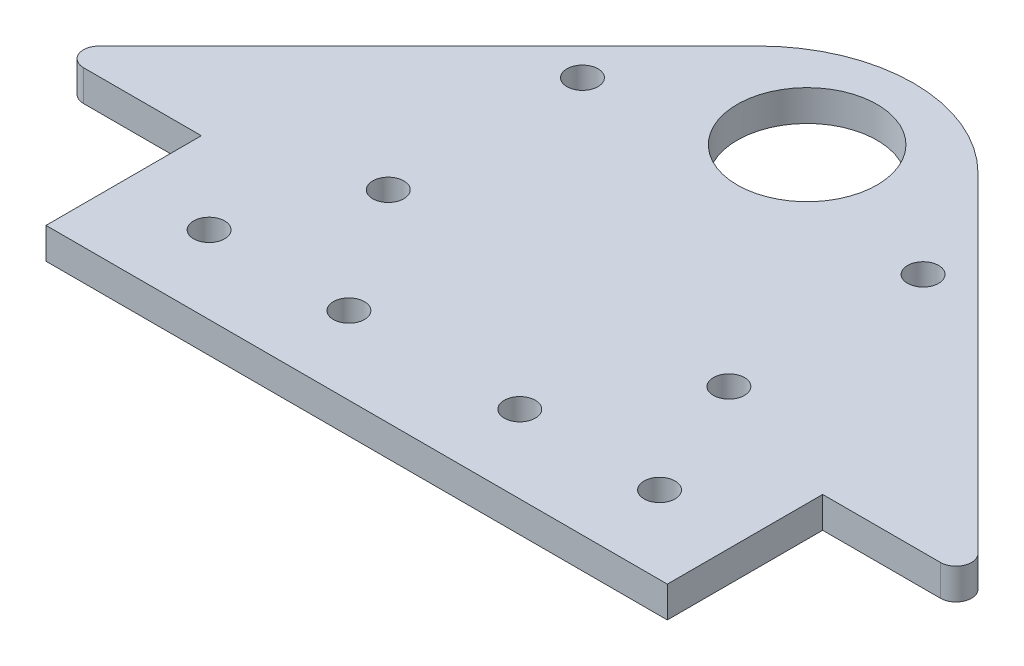
from build123d import *

# Parameters (mm, degrees)
SKETCH_1_R      = 2.25
SKETCH_1_R_2    = 0.5
EXTRUDE_1_DEPTH = 1
FILLET_1_R      = 5
FILLET_3_R      = 0.5


with BuildPart() as part:
    # 草图1 → 凸台-拉伸1 (new body)
    with BuildSketch(Plane(origin=(0, 0, 0), x_dir=(1, 0, 0), z_dir=(0, 1, 0))):
        Polygon((-15, 0), (0, 15), (15, 0), (10, 0), (10, -5), (-10, -5), (-10, 0), align=None)
        with Locations(Location((0, 9.5, 0), (0, 0, 270))):
            Circle(SKETCH_1_R, mode=Mode.SUBTRACT)
        with Locations(Location((-5.482233047, 7.75, 0), (0, 0, 270))):
            Circle(SKETCH_1_R_2, mode=Mode.SUBTRACT)
        with Locations(Location((5.482233047, 7.75, 0), (0, 0, 90))):
            Circle(SKETCH_1_R_2, mode=Mode.SUBTRACT)
        with Locations(Location((-5.482233047, 1.5, 0), (0, 0, 270))):
            Circle(SKETCH_1_R_2, mode=Mode.SUBTRACT)
        with Locations(Location((5.482233047, 1.5, 0), (0, 0, 90))):
            Circle(SKETCH_1_R_2, mode=Mode.SUBTRACT)
        with Locations(Location((-7.25, -2.5, 0), (0, 0, 270))):
            Circle(SKETCH_1_R_2, mode=Mode.SUBTRACT)
        with Locations(Location((-2.75, -2.5, 0), (0, 0, 270))):
            Circle(SKETCH_1_R_2, mode=Mode.SUBTRACT)
        with Locations(Location((2.75, -2.5, 0), (0, 0, 90))):
            Circle(SKETCH_1_R_2, mode=Mode.SUBTRACT)
        with Locations(Location((7.25, -2.5, 0), (0, 0, 90))):
            Circle(SKETCH_1_R_2, mode=Mode.SUBTRACT)
    extrude(amount=EXTRUDE_1_DEPTH)

    # 圆角1
    fillet_1_edges = [part.edges().sort_by_distance(p)[0] for p in [
        (0, 0.5, -15),
    ]]
    fillet(fillet_1_edges, radius=FILLET_1_R)

    # 圆角3
    fillet_3_edges = [part.edges().sort_by_distance(p)[0] for p in [
        (-15, 0.5, 0),
        (15, 0.5, 0),
    ]]
    fillet(fillet_3_edges, radius=FILLET_3_R)


solid = part.part
